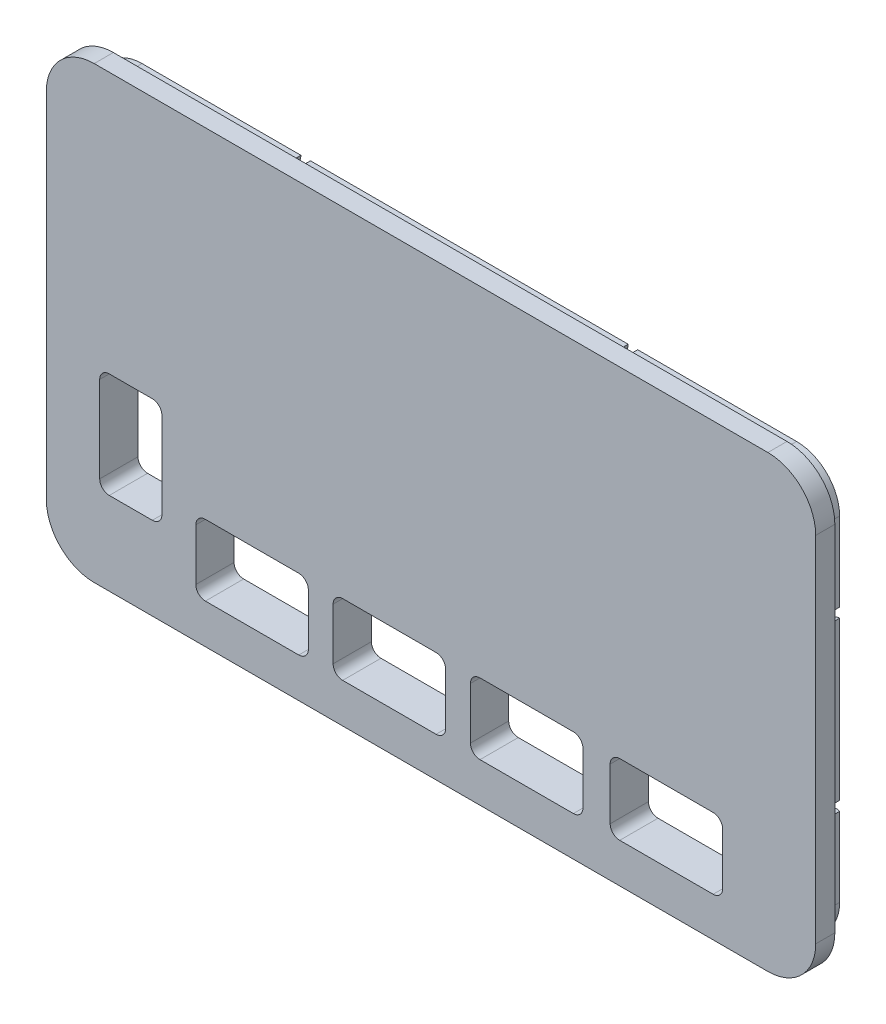
from build123d import *

# Parameters (mm, degrees)
EXTRUDE_1_DEPTH     = 2
EXTRUDE_2_DEPTH     = 2
CUT_EXTRUDE_1_DEPTH = 5


with BuildPart() as part:
    # 草图1 → 凸台-拉伸1 (new body)
    with BuildSketch(Plane.XY.offset(994.761746566)):
        with BuildLine():
            Line((-36.977217365, -23.153037779), (-20.375793692, -23.153037779))
            ThreePointArc((-20.375793692, -23.153037779), (-20.507759703, -22.594020785), (-20.875793692, -22.153037779))
            Line((-20.875793692, -22.153037779), (-18.875793692, -22.153037779))
            ThreePointArc((-18.875793692, -22.153037779), (-19.243827681, -22.594020785), (-19.375793692, -23.153037779))
            Line((-19.375793692, -23.153037779), (13.827053654, -23.153037779))
            ThreePointArc((13.827053654, -23.153037779), (13.695087643, -22.594020785), (13.327053654, -22.153037779))
            Line((13.327053654, -22.153037779), (15.327053654, -22.153037779))
            ThreePointArc((15.327053654, -22.153037779), (14.959019666, -22.594020785), (14.827053654, -23.153037779))
            Line((14.827053654, -23.153037779), (31.428477328, -23.153037779))
            ThreePointArc((31.428477328, -23.153037779), (34.610457843, -21.835018294), (35.928477328, -18.653037779))
            Line((35.928477328, -18.653037779), (35.928477328, -10.409369377))
            ThreePointArc((35.928477328, -10.409369377), (35.356461327, -10.413320038), (35.071587729, -10.909369377))
            Line((35.071587729, -10.909369377), (35.071587729, -8.909369377))
            ThreePointArc((35.071587729, -8.909369377), (35.432427989, -9.275228629), (35.928477328, -9.409369377))
            Line((35.928477328, -9.409369377), (35.928477328, 7.077967428))
            ThreePointArc((35.928477328, 7.077967428), (35.432427989, 6.943826681), (35.071587729, 6.577967428))
            Line((35.071587729, 6.577967428), (35.071587729, 8.577967428))
            ThreePointArc((35.071587729, 8.577967428), (35.356461327, 8.08191809), (35.928477328, 8.077967428))
            Line((35.928477328, 8.077967428), (35.928477328, 16.32163583))
            ThreePointArc((35.928477328, 16.32163583), (34.610457843, 19.503616346), (31.428477328, 20.82163583))
            Line((31.428477328, 20.82163583), (14.827053654, 20.82163583))
            ThreePointArc((14.827053654, 20.82163583), (14.959019666, 20.262618836), (15.327053654, 19.82163583))
            Line((15.327053654, 19.82163583), (13.327053654, 19.82163583))
            ThreePointArc((13.327053654, 19.82163583), (13.695087643, 20.262618836), (13.827053654, 20.82163583))
            Line((13.827053654, 20.82163583), (-19.375793692, 20.82163583))
            ThreePointArc((-19.375793692, 20.82163583), (-19.243827681, 20.262618836), (-18.875793692, 19.82163583))
            Line((-18.875793692, 19.82163583), (-20.875793692, 19.82163583))
            ThreePointArc((-20.875793692, 19.82163583), (-20.507759703, 20.262618836), (-20.375793692, 20.82163583))
            Line((-20.375793692, 20.82163583), (-36.977217365, 20.82163583))
            ThreePointArc((-36.977217365, 20.82163583), (-40.15919788, 19.503616346), (-41.477217365, 16.32163583))
            Line((-41.477217365, 16.32163583), (-41.477217365, 8.077967428))
            ThreePointArc((-41.477217365, 8.077967428), (-40.905201365, 8.08191809), (-40.620327767, 8.577967428))
            Line((-40.620327767, 8.577967428), (-40.620327767, 6.577967428))
            ThreePointArc((-40.620327767, 6.577967428), (-40.981168027, 6.943826681), (-41.477217365, 7.077967428))
            Line((-41.477217365, 7.077967428), (-41.477217365, -9.409369377))
            ThreePointArc((-41.477217365, -9.409369377), (-40.981168027, -9.275228629), (-40.620327767, -8.909369377))
            Line((-40.620327767, -8.909369377), (-40.620327767, -10.909369377))
            ThreePointArc((-40.620327767, -10.909369377), (-40.905201365, -10.413320038), (-41.477217365, -10.409369377))
            Line((-41.477217365, -10.409369377), (-41.477217365, -18.653037779))
            ThreePointArc((-41.477217365, -18.653037779), (-40.15919788, -21.835018294), (-36.977217365, -23.153037779))
        make_face()
    extrude(amount=EXTRUDE_1_DEPTH)

    # 草图2 → 凸台-拉伸2 (add)
    with BuildSketch(Plane.XY.offset(996.761746566)):
        with BuildLine():
            Line((-42.977217365, 17.32163583), (-42.977217365, -19.653037779))
            ThreePointArc((-42.977217365, -19.653037779), (-41.512751271, -23.188571685), (-37.977217365, -24.653037779))
            Line((-37.977217365, -24.653037779), (32.428477328, -24.653037779))
            ThreePointArc((32.428477328, -24.653037779), (35.964011233, -23.188571685), (37.428477328, -19.653037779))
            Line((37.428477328, -19.653037779), (37.428477328, 17.32163583))
            ThreePointArc((37.428477328, 17.32163583), (35.964011233, 20.857169736), (32.428477328, 22.32163583))
            Line((32.428477328, 22.32163583), (-37.977217365, 22.32163583))
            ThreePointArc((-37.977217365, 22.32163583), (-41.512751271, 20.857169736), (-42.977217365, 17.32163583))
        make_face()
    extrude(amount=EXTRUDE_2_DEPTH)

    # 草图3 → 切除-拉伸1 (cut)
    with BuildSketch(Plane.XY.offset(998.761746566)):
        with BuildLine():
            Line((-24.489796203, -20.520829455), (-18.469872403, -20.520829455))
            Line((-18.469872403, -20.520829455), (-16.599885103, -20.520829455))
            ThreePointArc((-16.599885103, -20.520829455), (-15.892778322, -20.227936236), (-15.599885103, -19.520829455))
            Line((-15.599885103, -19.520829455), (-15.599885103, -14.120887455))
            ThreePointArc((-15.599885103, -14.120887455), (-15.892778322, -13.413780673), (-16.599885103, -13.120887455))
            Line((-16.599885103, -13.120887455), (-26.359783503, -13.120887455))
            ThreePointArc((-26.359783503, -13.120887455), (-27.066890284, -13.413780673), (-27.359783503, -14.120887455))
            Line((-27.359783503, -14.120887455), (-27.359783503, -19.520829455))
            ThreePointArc((-27.359783503, -19.520829455), (-27.066890284, -20.227936236), (-26.359783503, -20.520829455))
            Line((-26.359783503, -20.520829455), (-24.489796203, -20.520829455))
        make_face()
        with BuildLine():
            Line((-10.138767501, -20.520829455), (-4.118843701, -20.520829455))
            Line((-4.118843701, -20.520829455), (-2.248856401, -20.520829455))
            ThreePointArc((-2.248856401, -20.520829455), (-1.54174962, -20.227936236), (-1.248856401, -19.520829455))
            Line((-1.248856401, -19.520829455), (-1.248856401, -14.120887455))
            ThreePointArc((-1.248856401, -14.120887455), (-1.54174962, -13.413780673), (-2.248856401, -13.120887455))
            Line((-2.248856401, -13.120887455), (-12.008754801, -13.120887455))
            ThreePointArc((-12.008754801, -13.120887455), (-12.715861582, -13.413780673), (-13.008754801, -14.120887455))
            Line((-13.008754801, -14.120887455), (-13.008754801, -19.520829455))
            ThreePointArc((-13.008754801, -19.520829455), (-12.715861582, -20.227936236), (-12.008754801, -20.520829455))
            Line((-12.008754801, -20.520829455), (-10.138767501, -20.520829455))
        make_face()
        with BuildLine():
            Line((4.212261201, -20.520829455), (10.232185001, -20.520829455))
            Line((10.232185001, -20.520829455), (12.102172301, -20.520829455))
            ThreePointArc((12.102172301, -20.520829455), (12.809279082, -20.227936236), (13.102172301, -19.520829455))
            Line((13.102172301, -19.520829455), (13.102172301, -14.120887455))
            ThreePointArc((13.102172301, -14.120887455), (12.809279082, -13.413780673), (12.102172301, -13.120887455))
            Line((12.102172301, -13.120887455), (2.342273901, -13.120887455))
            ThreePointArc((2.342273901, -13.120887455), (1.63516712, -13.413780673), (1.342273901, -14.120887455))
            Line((1.342273901, -14.120887455), (1.342273901, -19.520829455))
            ThreePointArc((1.342273901, -19.520829455), (1.63516712, -20.227936236), (2.342273901, -20.520829455))
            Line((2.342273901, -20.520829455), (4.212261201, -20.520829455))
        make_face()
        with BuildLine():
            Line((18.817290411, -20.520829455), (24.837214211, -20.520829455))
            Line((24.837214211, -20.520829455), (26.707201511, -20.520829455))
            ThreePointArc((26.707201511, -20.520829455), (27.414308292, -20.227936236), (27.707201511, -19.520829455))
            Line((27.707201511, -19.520829455), (27.707201511, -14.120887455))
            ThreePointArc((27.707201511, -14.120887455), (27.414308292, -13.413780673), (26.707201511, -13.120887455))
            Line((26.707201511, -13.120887455), (16.947303111, -13.120887455))
            ThreePointArc((16.947303111, -13.120887455), (16.24019633, -13.413780673), (15.947303111, -14.120887455))
            Line((15.947303111, -14.120887455), (15.947303111, -19.520829455))
            ThreePointArc((15.947303111, -19.520829455), (16.24019633, -20.227936236), (16.947303111, -20.520829455))
            Line((16.947303111, -20.520829455), (18.817290411, -20.520829455))
        make_face()
        with BuildLine():
            Line((-37.402959537, -5.978719817), (-37.402959537, -14.978719817))
            ThreePointArc((-37.402959537, -14.978719817), (-37.110066318, -15.685826598), (-36.402959537, -15.978719817))
            Line((-36.402959537, -15.978719817), (-31.902959537, -15.978719817))
            ThreePointArc((-31.902959537, -15.978719817), (-31.195852756, -15.685826598), (-30.902959537, -14.978719817))
            Line((-30.902959537, -14.978719817), (-30.902959537, -5.978719817))
            ThreePointArc((-30.902959537, -5.978719817), (-31.195852756, -5.271613035), (-31.902959537, -4.978719817))
            Line((-31.902959537, -4.978719817), (-36.402959537, -4.978719817))
            ThreePointArc((-36.402959537, -4.978719817), (-37.110066318, -5.271613035), (-37.402959537, -5.978719817))
        make_face()
    extrude(amount=-CUT_EXTRUDE_1_DEPTH, mode=Mode.SUBTRACT)


solid = part.part
